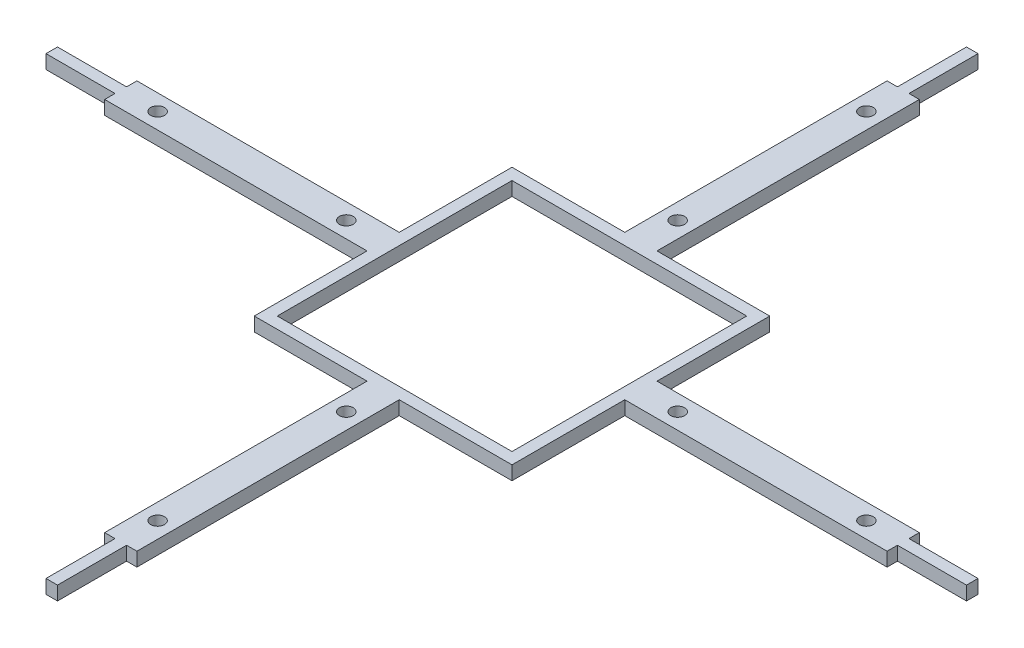
from build123d import *

# Parameters (mm, degrees)
SKETCH1_W           = 51
SKETCH1_H           = 51
SKETCH1_R           = 1.5
BOSS_EXTRUDE1_DEPTH = 3


with BuildPart() as part:
    # Sketch1 → Boss-Extrude1 (new body)
    with BuildSketch(Plane(origin=(0, 0, 0), x_dir=(1, 0, 0), z_dir=(0, 1, 0))):
        Polygon((85, 1.25), (85, 3.5), (28, 3.5), (28, 28), (3.5, 28), (3.5, 85), (1.25, 85), (1.25, 100), (-1.25, 100), (-1.25, 85), (-3.5, 85), (-3.5, 28), (-28, 28), (-28, 3.5), (-85, 3.5), (-85, 1.25), (-100, 1.25), (-100, -1.25), (-85, -1.25), (-85, -3.5), (-28, -3.5), (-28, -28), (-3.5, -28), (-3.5, -85), (-1.25, -85), (-1.25, -100), (1.25, -100), (1.25, -85), (3.5, -85), (3.5, -28), (28, -28), (28, -3.5), (85, -3.5), (85, -1.25), (100, -1.25), (100, 1.25), align=None)
        Rectangle(SKETCH1_W, SKETCH1_H, mode=Mode.SUBTRACT)
        with Locations(Location((36, 0, 0), (0, 0, 270))):
            Circle(SKETCH1_R, mode=Mode.SUBTRACT)
        with Locations(Location((77, 0, 0), (0, 0, 270))):
            Circle(SKETCH1_R, mode=Mode.SUBTRACT)
        with Locations(Location((0, 77, 0), (0, 0, 270))):
            Circle(SKETCH1_R, mode=Mode.SUBTRACT)
        with Locations(Location((0, 36, 0), (0, 0, 270))):
            Circle(SKETCH1_R, mode=Mode.SUBTRACT)
        with Locations(Location((0, -36, 0), (0, 0, 270))):
            Circle(SKETCH1_R, mode=Mode.SUBTRACT)
        with Locations(Location((0, -77, 0), (0, 0, 270))):
            Circle(SKETCH1_R, mode=Mode.SUBTRACT)
        with Locations(Location((-36, 0, 0), (0, 0, 270))):
            Circle(SKETCH1_R, mode=Mode.SUBTRACT)
        with Locations(Location((-77, 0, 0), (0, 0, 270))):
            Circle(SKETCH1_R, mode=Mode.SUBTRACT)
    extrude(amount=BOSS_EXTRUDE1_DEPTH)


solid = part.part
